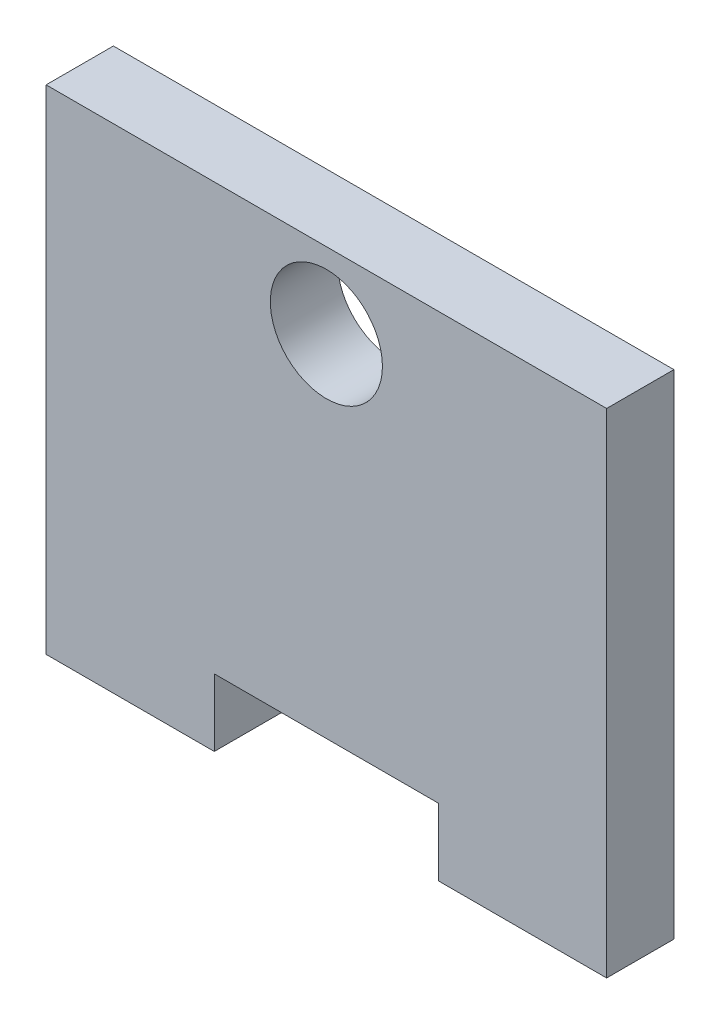
from build123d import *

# Parameters (mm, degrees)
ESQUISSE1_R        = 5
BOSS_EXTRU_1_DEPTH = 6


with BuildPart() as part:
    # Esquisse1 → Boss.-Extru.1 (new body)
    with BuildSketch(Plane.XY):
        Polygon((15, 0), (35, 0), (35, -6), (50, -6), (50, 0), (50, 38), (0, 38), (0, 0), (0, -6), (15, -6), align=None)
        with Locations((25, 31.25)):
            Circle(ESQUISSE1_R, mode=Mode.SUBTRACT)
    extrude(amount=BOSS_EXTRU_1_DEPTH)


solid = part.part
